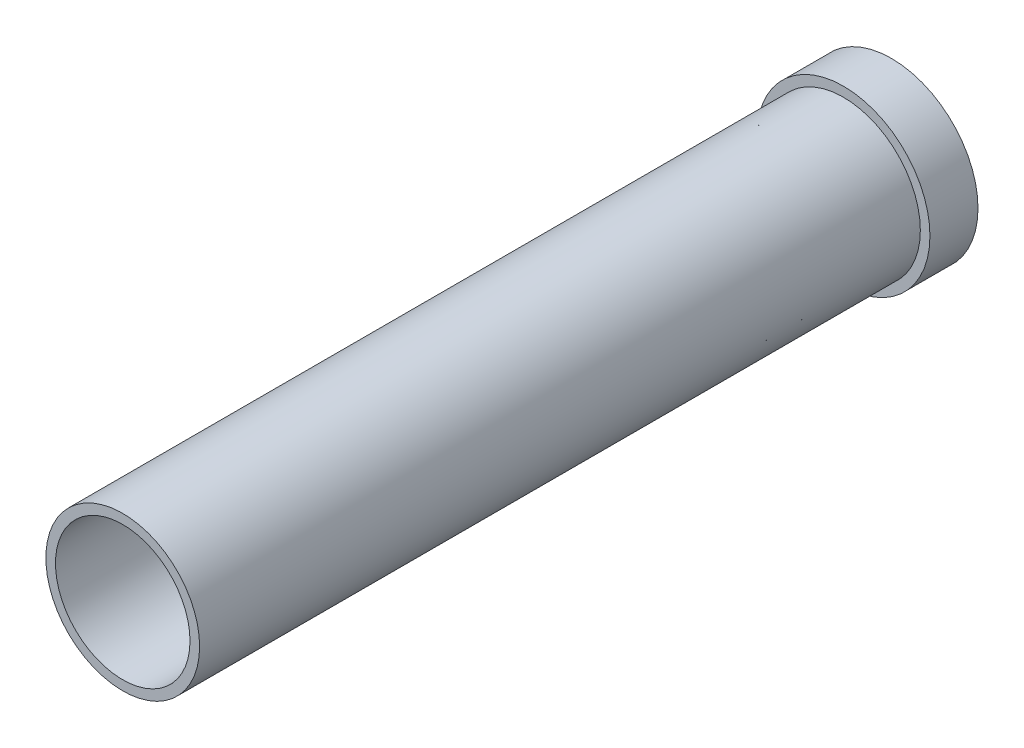
from build123d import *

# Parameters (mm, degrees)
SCHIZZO1_R                   = 9.75
SCHIZZO1_R_2                 = 7
ESTRUSIONE_ESTRUSIONE1_DEPTH = 5
SCHIZZO3_R                   = 8
SCHIZZO3_R_2                 = 7
ESTRUSIONE_ESTRUSIONE2_DEPTH = 75
SMUSSO1_SIZE                 = 2
SCHIZZO4_R                   = 9.75
SCHIZZO4_R_2                 = 9
TAGLIO_ESTRUSIONE1_DEPTH     = 10


with BuildPart() as part:
    # Schizzo1 → Estrusione-Estrusione1 (new body)
    with BuildSketch(Plane.XY):
        Circle(SCHIZZO1_R)
        Circle(SCHIZZO1_R_2, mode=Mode.SUBTRACT)
    extrude(amount=ESTRUSIONE_ESTRUSIONE1_DEPTH)

    # Schizzo3 → Estrusione-Estrusione2 (add)
    with BuildSketch(Plane.XY.offset(5)):
        Circle(SCHIZZO3_R)
        Circle(SCHIZZO3_R_2, mode=Mode.SUBTRACT)
    extrude(amount=ESTRUSIONE_ESTRUSIONE2_DEPTH)

    # Smusso1
    smusso1_edges = [part.edges().sort_by_distance(p)[0] for p in [
        (-7, 0, 0),
    ]]
    chamfer(smusso1_edges, length=SMUSSO1_SIZE)

    # Schizzo4 → Taglio-Estrusione1 (cut)
    with BuildSketch(Plane(origin=(0, 0, 0), x_dir=(-1, 0, 0), z_dir=(0, 0, -1))):
        Circle(SCHIZZO4_R)
        Circle(SCHIZZO4_R_2, mode=Mode.SUBTRACT)
    extrude(amount=-TAGLIO_ESTRUSIONE1_DEPTH, mode=Mode.SUBTRACT)


solid = part.part
